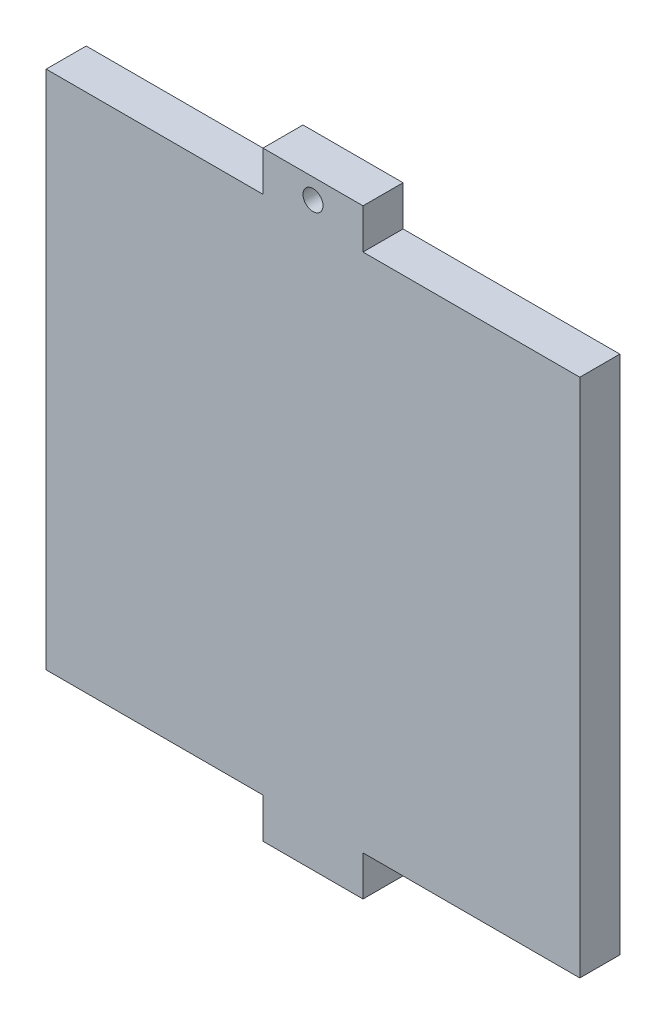
from build123d import *

# Parameters (mm, degrees)
BOSS_EXTRU_1_DEPTH      = 6
ESQUISSE2_R             = 1.5
ENL_V_MAT_EXTRU_1_DEPTH = 6
ESQUISSE3_R             = 2.995
ENL_V_MAT_EXTRU_2_DEPTH = 3


with BuildPart() as part:
    # Esquisse1 → Boss.-Extru.1 (new body)
    with BuildSketch(Plane.XY):
        Polygon((-47.5, 78), (-80, 78), (-80, 0), (-47.5, 0), (-47.5, -6), (-32.5, -6), (-32.5, 0), (0, 0), (0, 78), (-32.5, 78), (-32.5, 84), (-47.5, 84), align=None)
    extrude(amount=BOSS_EXTRU_1_DEPTH)

    # Esquisse2 → Enlèv. mat.-Extru.1 (cut)
    with BuildSketch(Plane(origin=(0, 0, 0), x_dir=(-1, 0, 0), z_dir=(0, 0, -1))):
        with Locations((40, 81)):
            Circle(ESQUISSE2_R)
    extrude(amount=-ENL_V_MAT_EXTRU_1_DEPTH, mode=Mode.SUBTRACT)

    # Esquisse3 → Enlèv. mat.-Extru.2 (cut)
    with BuildSketch(Plane(origin=(0, 0, 0), x_dir=(-1, 0, 0), z_dir=(0, 0, -1))):
        with Locations((40, 81)):
            Circle(ESQUISSE3_R)
    extrude(amount=-ENL_V_MAT_EXTRU_2_DEPTH, mode=Mode.SUBTRACT)


solid = part.part
